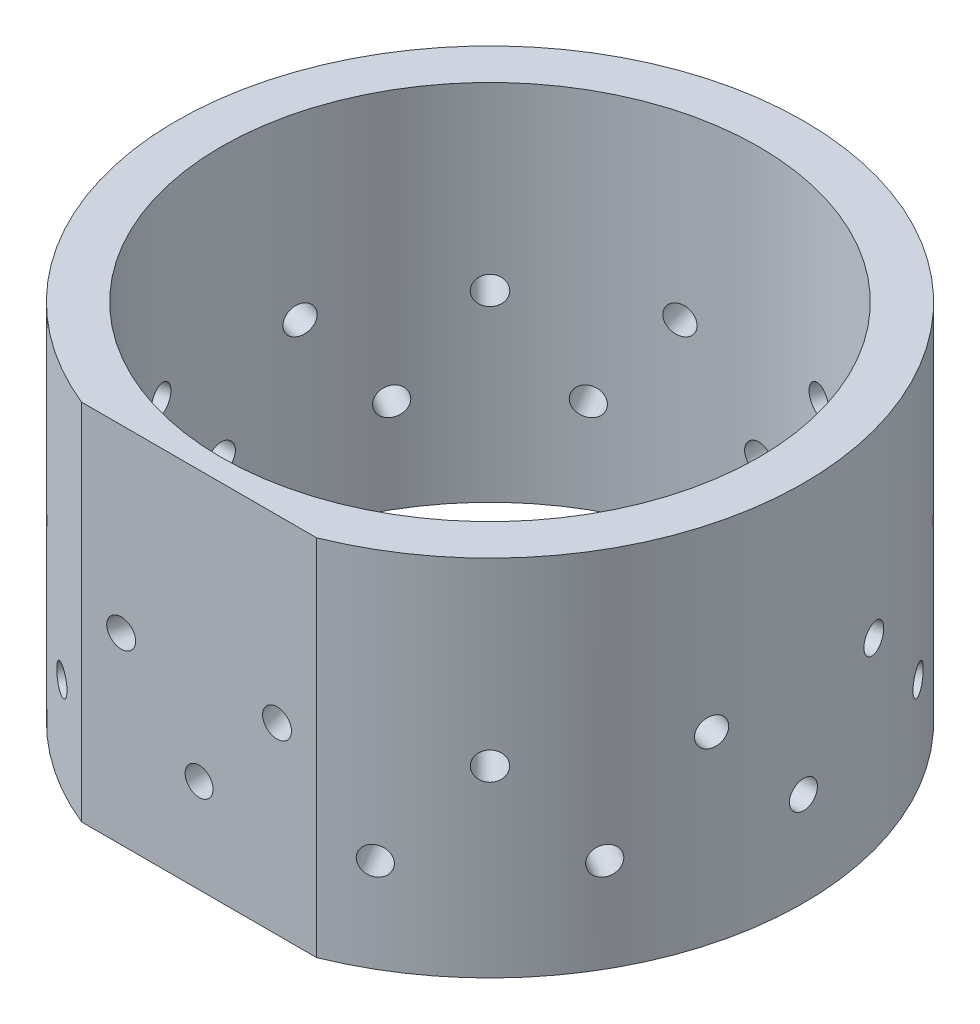
from build123d import *

# Parameters (mm, degrees)
SKETCH1_R           = 89.027
SKETCH1_R_2         = 76.327
BOSS_EXTRUDE1_DEPTH = 103.1875
SKETCH3_R           = 3.96875
CUT_EXTRUDE1_DEPTH  = 15.24
CIRPATTERN1_COUNT   = 12
SKETCH4_R           = 3.96875
CUT_EXTRUDE2_DEPTH  = 15.24
CIRPATTERN2_COUNT   = 12


with BuildPart() as part:
    # Sketch1 → Boss-Extrude1 (new body)
    with BuildSketch(Plane(origin=(0, 0, 0), x_dir=(1, 0, 0), z_dir=(0, 1, 0))):
        with Locations(Location((0, 0, 0), (0, 0, 270))):
            Circle(SKETCH1_R)
        with Locations(Location((0, 0, 0), (0, 0, 270))):
            Circle(SKETCH1_R_2, mode=Mode.SUBTRACT)
    extrude(amount=BOSS_EXTRUDE1_DEPTH)

    # Sketch3 → Cut-Extrude1 (cut)
    with BuildSketch(Plane(origin=(0, 0, -89.027), x_dir=(-1, 0, 0), z_dir=(0, 0, -1))):
        with Locations(Location((0, 26.67, 0), (0, 0, 90))):
            Circle(SKETCH3_R)
    cut_extrude1 = extrude(amount=-CUT_EXTRUDE1_DEPTH, mode=Mode.SUBTRACT)

    # CirPattern1: Cut-Extrude1 ×12 about axis
    cirpattern1_axis = Axis((0, 103.1875, 0), (0, -1, 0))
    for i in range(1, CIRPATTERN1_COUNT):
        add(cut_extrude1.rotate(cirpattern1_axis, i * 360 / CIRPATTERN1_COUNT), mode=Mode.SUBTRACT)

    # Sketch4 → Cut-Extrude2 (cut)
    with BuildSketch(Plane(origin=(-23.041883128, 0, 85.993478537), x_dir=(0, -1, 0), z_dir=(-0.25881904510252135, 0, 0.9659258262890681))):
        with Locations(Location((-52.07, 0, 0), (0, 0, 90))):
            Circle(SKETCH4_R)
    cut_extrude2 = extrude(amount=-CUT_EXTRUDE2_DEPTH, mode=Mode.SUBTRACT)

    # CirPattern2: Cut-Extrude2 ×12 about axis
    cirpattern2_axis = Axis((0, 103.1875, 0), (0, -1, 0))
    for i in range(1, CIRPATTERN2_COUNT):
        add(cut_extrude2.rotate(cirpattern2_axis, i * 360 / CIRPATTERN2_COUNT), mode=Mode.SUBTRACT)

    # Split1
    split(bisect_by=Plane.XY.offset(82.55), keep=Keep.BOTTOM)


solid = part.part
